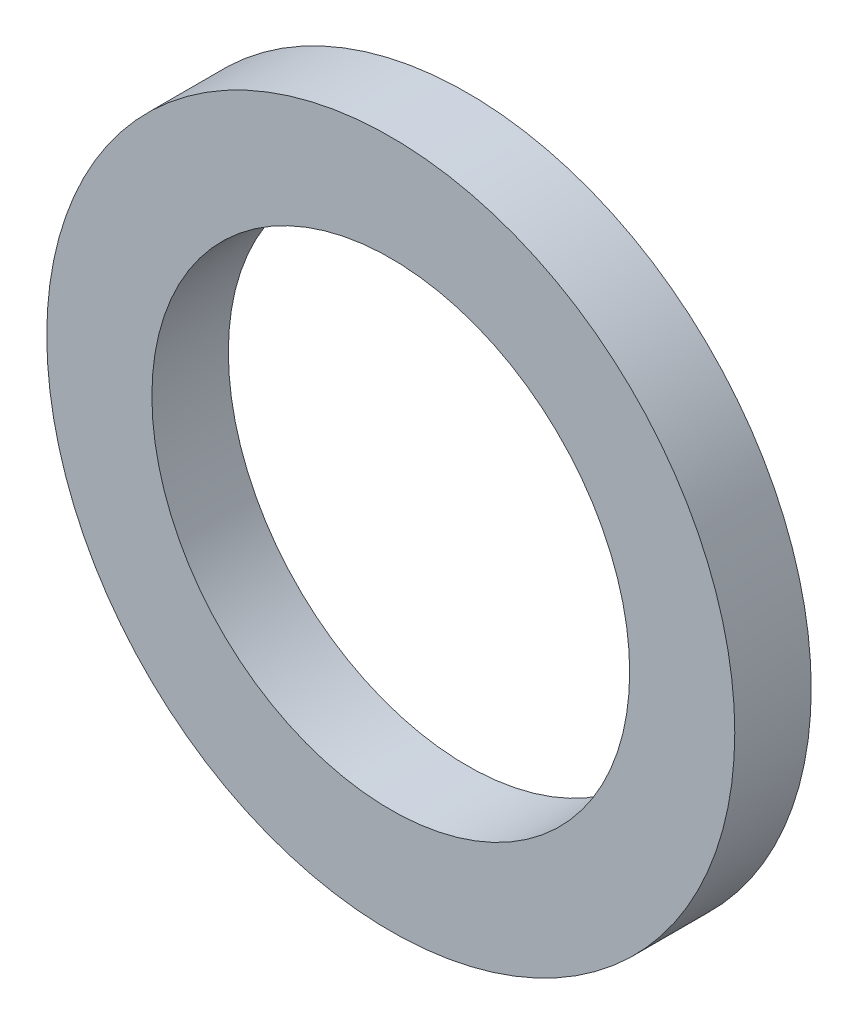
from build123d import *

# Parameters (mm, degrees)
SKETCH_1_R      = 36
SKETCH_1_R_2    = 25
EXTRUDE_1_DEPTH = 8


with BuildPart() as part:
    # 草图1 → 凸台-拉伸1 (new body)
    with BuildSketch(Plane.XY):
        Circle(SKETCH_1_R)
        Circle(SKETCH_1_R_2, mode=Mode.SUBTRACT)
    extrude(amount=EXTRUDE_1_DEPTH)


solid = part.part
